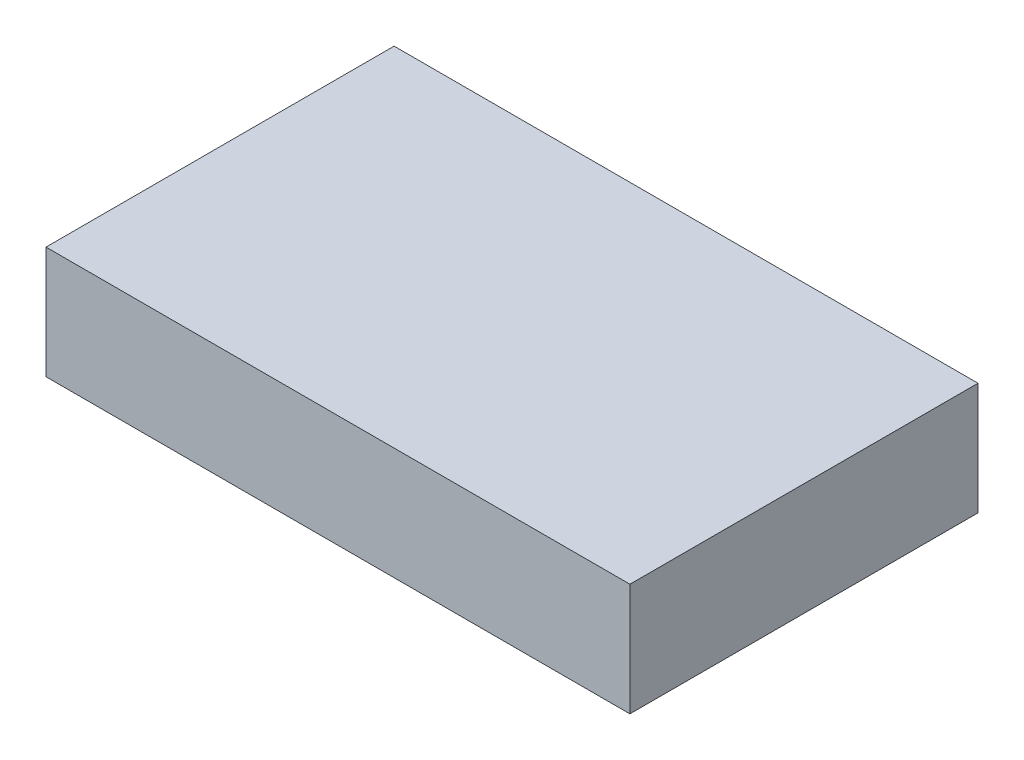
from build123d import *

# Parameters (mm, degrees)
SKETCH1_W           = 165.1
SKETCH1_H           = 98.425
BOSS_EXTRUDE1_DEPTH = 31.75


with BuildPart() as part:
    # Sketch1 → Boss-Extrude1 (new body)
    with BuildSketch(Plane(origin=(0, 0, 0), x_dir=(1, 0, 0), z_dir=(0, 1, 0))):
        Rectangle(SKETCH1_W, SKETCH1_H)
    extrude(amount=BOSS_EXTRUDE1_DEPTH)


solid = part.part
